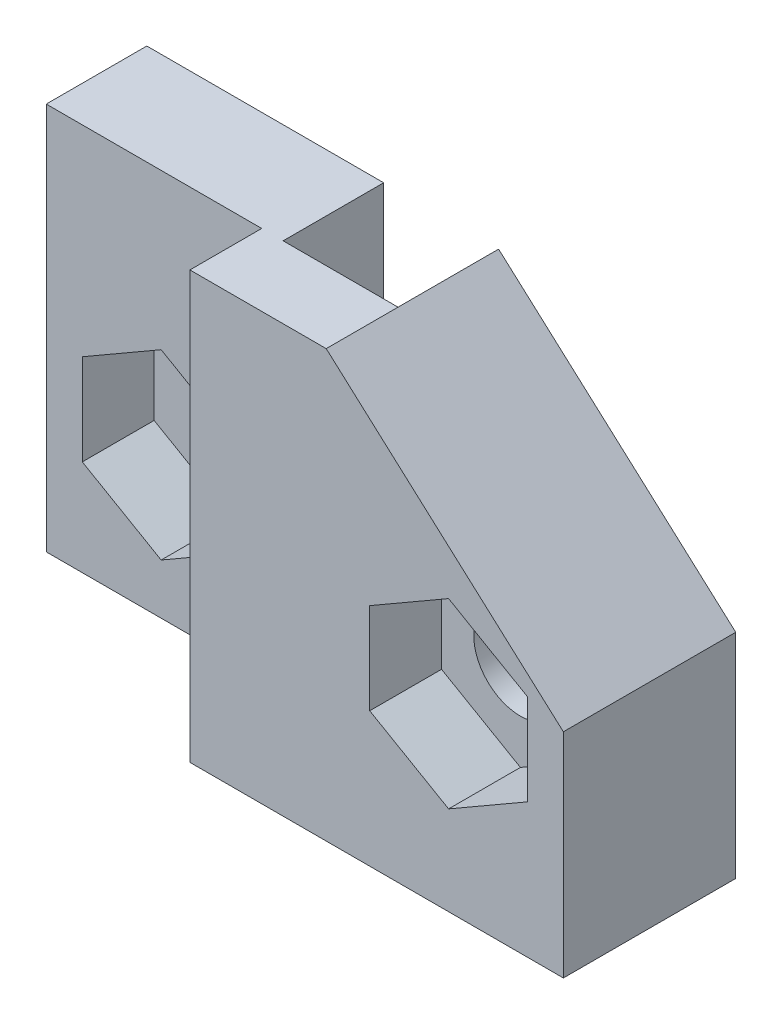
from build123d import *

# Parameters (mm, degrees)
CROQUIS1_R                   = 1.5
SALIENTE_EXTRUIR1_DEPTH      = 3.5
SALIENTE_EXTRUIR2_DEPTH      = 2.5
SALIENTE_EXTRUIR2_DEPTH_BACK = 3.5
CROQUIS3_R                   = 1.625
CORTAR_EXTRUIR1_DEPTH        = 2.5
CORTAR_EXTRUIR2_DEPTH        = 2.5
CROQUIS6_W                   = 4
CROQUIS6_H                   = 8.575
SALIENTE_EXTRUIR4_DEPTH      = 2.5


with BuildPart() as part:
    # Croquis1 → Saliente-Extruir1 (new body)
    with BuildSketch(Plane.XY):
        Polygon((168.732371, -66.648646), (161.232371, -66.648646), (161.232371, -80.148646), (167.387371, -80.148646), (168.732371, -81.493646), (168.732371, -80.148646), align=None)
        with Locations((165.232371, -75.223646)):
            Circle(CROQUIS1_R, mode=Mode.SUBTRACT)
    extrude(amount=SALIENTE_EXTRUIR1_DEPTH)

    # Croquis3 → Saliente-Extruir2 (add, two sides: drawn at the far end of the back side and taken through both)
    with BuildSketch(Plane.XY.offset(3.5).offset(-SALIENTE_EXTRUIR2_DEPTH_BACK)):
        Polygon((168.732371, -81.493646), (181.732371, -81.493646), (181.732371, -74.071146), (173.47767153, -66.648646), (173.47767153, -75.223646), (169.47767153, -75.223646), (169.47767153, -66.648646), (168.732371, -66.648646), align=None)
        with Locations((177.73707047, -75.223646)):
            Circle(CROQUIS3_R, mode=Mode.SUBTRACT)
    extrude(amount=SALIENTE_EXTRUIR2_DEPTH + SALIENTE_EXTRUIR2_DEPTH_BACK)

    # Croquis4 → Cortar-Extruir1 (cut)
    with BuildSketch(Plane.XY.offset(6)):
        Polygon((177.73707047, -78.393646), (180.482371, -76.808646), (180.482371, -73.638646), (177.73707047, -72.053646), (174.99176994, -73.638646), (174.99176994, -76.808646), align=None)
    extrude(amount=-CORTAR_EXTRUIR1_DEPTH, mode=Mode.SUBTRACT)

    # Croquis5 → Cortar-Extruir2 (cut)
    with BuildSketch(Plane.XY.offset(3.5)):
        Polygon((165.232371, -78.393646), (167.97767153, -76.808646), (167.97767153, -73.638646), (165.232371, -72.053646), (162.48707047, -73.638646), (162.48707047, -76.808646), align=None)
    extrude(amount=-CORTAR_EXTRUIR2_DEPTH, mode=Mode.SUBTRACT)

    # Croquis6 → Saliente-Extruir4 (add)
    with BuildSketch(Plane.XY.offset(6)):
        with Locations((171.47767153, -70.936146)):
            Rectangle(CROQUIS6_W, CROQUIS6_H)
    extrude(amount=-SALIENTE_EXTRUIR4_DEPTH)


solid = part.part
